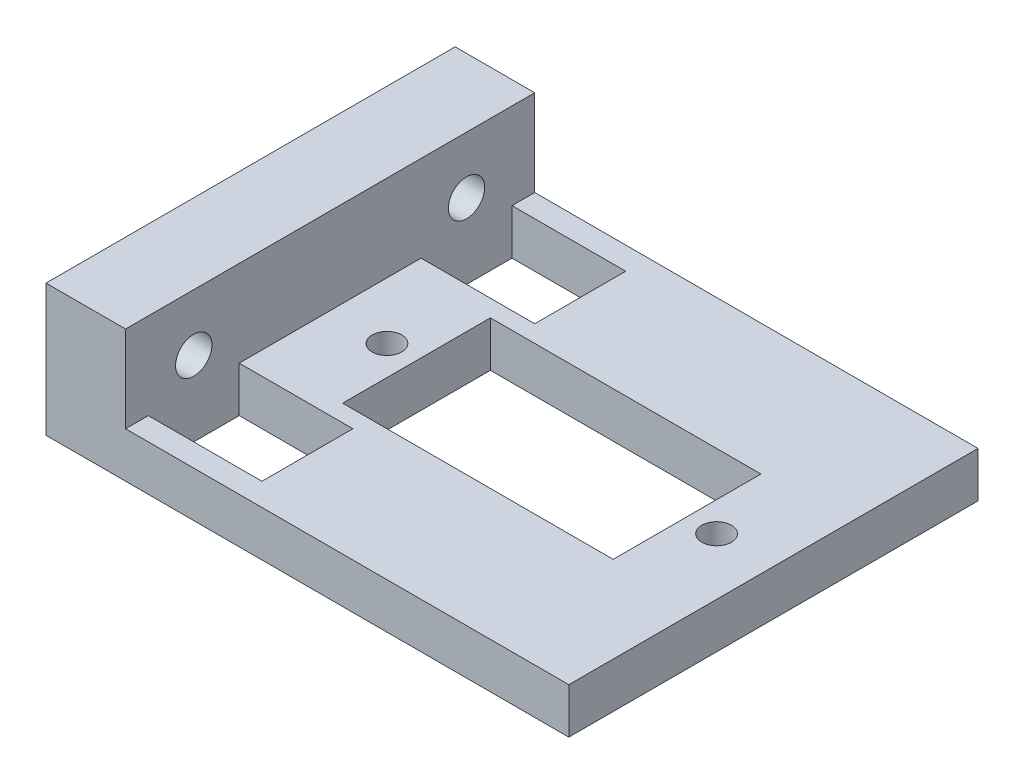
from build123d import *

# Parameters (mm, degrees)
SERVO_SHELF_START                = 21.4
SERVO_SHELF_PROFILE_W            = 46
SERVO_SHELF_PROFILE_H            = 36
SERVO_SHELF_DEPTH                = 4
REAR_CLAMPING_BLOCK_START        = -18
REAR_CLAMPING_BLOCK_PROFILE_W    = 7
REAR_CLAMPING_BLOCK_PROFILE_H    = 10
REAR_CLAMPING_BLOCK_DEPTH        = 36
SERVO_BODY_WINDOW_START          = 20.4
SERVO_BODY_WINDOW_PROFILE_W      = 23.8
SERVO_BODY_WINDOW_PROFILE_H      = 13
SERVO_BODY_WINDOW_DEPTH          = 25.744213361
YAW_SERVO_M2_FASTENERS_START     = 20.4
YAW_SERVO_M2_FASTENERS_PROFILE_R = 1.3
YAW_SERVO_M2_FASTENERS_DEPTH     = 25.744213361
LEFT_NUT_ACCESS_START            = 20
LEFT_NUT_ACCESS_PROFILE_W        = 10
LEFT_NUT_ACCESS_PROFILE_H        = 8
LEFT_NUT_ACCESS_DEPTH            = 26.144213361
RIGHT_NUT_ACCESS_START           = 20
RIGHT_NUT_ACCESS_PROFILE_W       = 10
RIGHT_NUT_ACCESS_PROFILE_H       = 8
RIGHT_NUT_ACCESS_DEPTH           = 26.144213361
REAR_CLAMPING_M3_HOLES_START     = -25
REAR_CLAMPING_M3_PROFILE_R       = 1.6
REAR_CLAMPING_M3_HOLES_DEPTH     = 11


with BuildPart() as part:
    # Servo_shelf_profile → Servo_shelf (new body)
    with BuildSketch(Plane(origin=(0, 0, 0), x_dir=(1, 0, 0), z_dir=(0, 1, 0)).offset(SERVO_SHELF_START)):
        with Locations((2, 0)):
            Rectangle(SERVO_SHELF_PROFILE_W, SERVO_SHELF_PROFILE_H)
    extrude(amount=SERVO_SHELF_DEPTH)

    # Rear_clamping_block_profile → Rear_clamping_block (add)
    with BuildSketch(Plane.XY.offset(REAR_CLAMPING_BLOCK_START)):
        with Locations((-17.5, 28)):
            Rectangle(REAR_CLAMPING_BLOCK_PROFILE_W, REAR_CLAMPING_BLOCK_PROFILE_H)
    extrude(amount=REAR_CLAMPING_BLOCK_DEPTH)

    # Servo_body_window_profile → Servo_body_window (cut, through all)
    with BuildSketch(Plane(origin=(0, 0, 0), x_dir=(1, 0, 0), z_dir=(0, 1, 0)).offset(SERVO_BODY_WINDOW_START)):
        with Locations((5.5, 0)):
            Rectangle(SERVO_BODY_WINDOW_PROFILE_W, SERVO_BODY_WINDOW_PROFILE_H)
    extrude(amount=SERVO_BODY_WINDOW_DEPTH, mode=Mode.SUBTRACT)

    # Yaw_servo_M2_fasteners_profile → Yaw_servo_M2_fasteners (cut, through all)
    with BuildSketch(Plane(origin=(0, 0, 0), x_dir=(1, 0, 0), z_dir=(0, 1, 0)).offset(YAW_SERVO_M2_FASTENERS_START)):
        with Locations(Location((-9, 0, 0), (0, 0, 90))):
            Circle(YAW_SERVO_M2_FASTENERS_PROFILE_R)
        with Locations(Location((20, 0, 0), (0, 0, 90))):
            Circle(YAW_SERVO_M2_FASTENERS_PROFILE_R)
    extrude(amount=YAW_SERVO_M2_FASTENERS_DEPTH, mode=Mode.SUBTRACT)

    # Left_nut_access_profile → Left_nut_access (cut, through all)
    with BuildSketch(Plane(origin=(0, 0, 0), x_dir=(1, 0, 0), z_dir=(0, 1, 0)).offset(LEFT_NUT_ACCESS_START)):
        with Locations((-9, 12)):
            Rectangle(LEFT_NUT_ACCESS_PROFILE_W, LEFT_NUT_ACCESS_PROFILE_H)
    extrude(amount=LEFT_NUT_ACCESS_DEPTH, mode=Mode.SUBTRACT)

    # Right_nut_access_profile → Right_nut_access (cut, through all)
    with BuildSketch(Plane(origin=(0, 0, 0), x_dir=(1, 0, 0), z_dir=(0, 1, 0)).offset(RIGHT_NUT_ACCESS_START)):
        with Locations((-9, -12)):
            Rectangle(RIGHT_NUT_ACCESS_PROFILE_W, RIGHT_NUT_ACCESS_PROFILE_H)
    extrude(amount=RIGHT_NUT_ACCESS_DEPTH, mode=Mode.SUBTRACT)

    # Rear_clamping_M3_profile → Rear_clamping_M3_holes (cut)
    with BuildSketch(Plane(origin=(0, 0, 0), x_dir=(0, 0, -1), z_dir=(1, 0, 0)).offset(REAR_CLAMPING_M3_HOLES_START)):
        with Locations((12, 28)):
            Circle(REAR_CLAMPING_M3_PROFILE_R)
        with Locations((-12, 28)):
            Circle(REAR_CLAMPING_M3_PROFILE_R)
    extrude(amount=REAR_CLAMPING_M3_HOLES_DEPTH, mode=Mode.SUBTRACT)


solid = part.part
